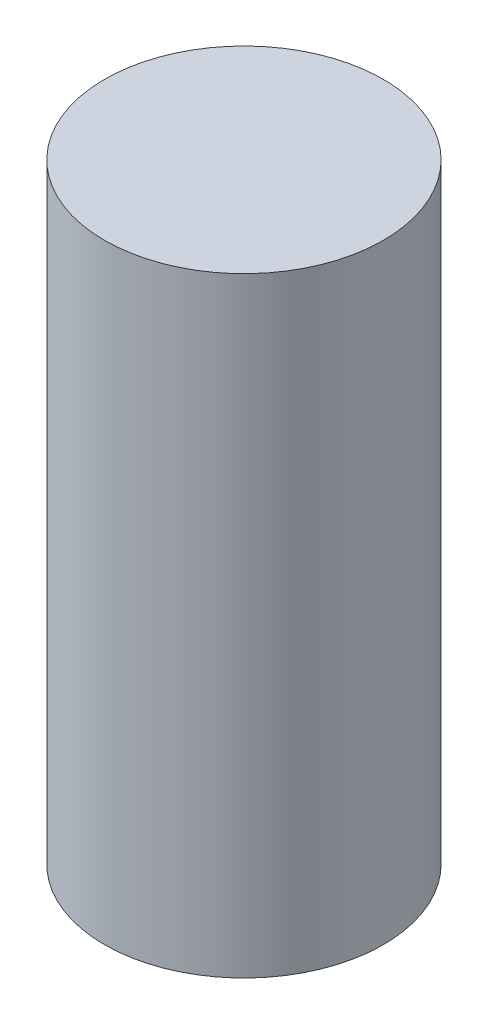
from build123d import *

# Parameters (mm, degrees)
SKETCH_1_R      = 8
EXTRUDE_1_DEPTH = 35


with BuildPart() as part:
    # 草图1 → 凸台-拉伸1 (new body)
    with BuildSketch(Plane(origin=(0, 0, 0), x_dir=(1, 0, 0), z_dir=(0, 1, 0))):
        with Locations(Location((0, 0, 0), (0, 0, 270))):
            Circle(SKETCH_1_R)
    extrude(amount=EXTRUDE_1_DEPTH)


solid = part.part
